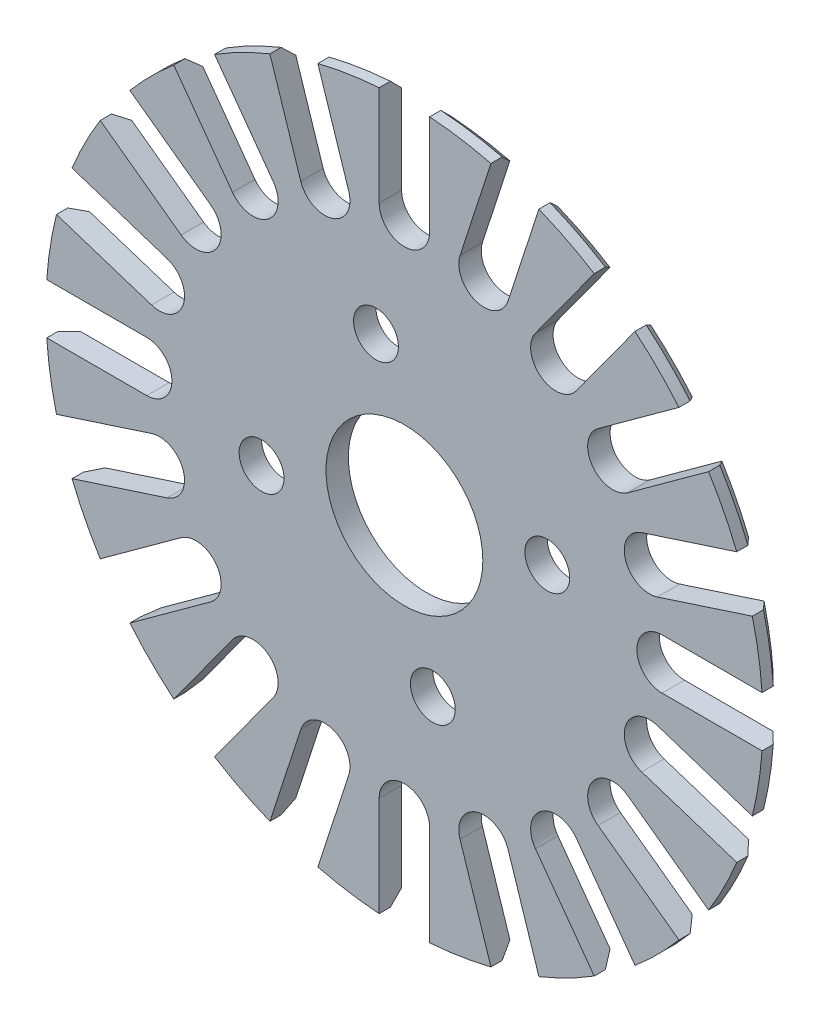
from build123d import *

# Parameters (mm, degrees)
SKETCH_1_R               = 32
EXTRUDE_1_DEPTH          = 2
SKETCH_2_R               = 7
CUT_EXTRUDE_2_DEPTH      = 3
SKETCH_3_R               = 2
CUT_EXTRUDE_3_DEPTH      = 3
PATTERN_CIRCULAR_1_COUNT = 4
CHAMFER_1_SIZE           = 1
CUT_EXTRUDE_START        = -3
CUT_EXTRUDE_4_DEPTH      = 3
PATTERN_CIRCULAR_3_COUNT = 20


with BuildPart() as part:
    # 草图1 → 拉伸1 (new body)
    with BuildSketch(Plane.XY):
        Circle(SKETCH_1_R)
    extrude(amount=EXTRUDE_1_DEPTH)

    # 草图2 → 拉伸2 (cut)
    with BuildSketch(Plane.XY.offset(2)):
        Circle(SKETCH_2_R)
    extrude(amount=-CUT_EXTRUDE_2_DEPTH, mode=Mode.SUBTRACT)

    # 草图3 → 拉伸3 (cut)
    with BuildSketch(Plane.XY.offset(2)):
        with Locations((-2.536174186, 12.750208645)):
            Circle(SKETCH_3_R)
    cut_extrude_3 = extrude(amount=-CUT_EXTRUDE_3_DEPTH, mode=Mode.SUBTRACT)

    # 阵列(圆周)1: 拉伸3 ×4 about axis
    pattern_circular_1_axis = Axis((0, 0, 0), (0, 0, 1))
    for i in range(1, PATTERN_CIRCULAR_1_COUNT):
        add(cut_extrude_3.rotate(pattern_circular_1_axis, i * 360 / PATTERN_CIRCULAR_1_COUNT), mode=Mode.SUBTRACT)

    # 倒角1
    chamfer_1_edges = [part.edges().sort_by_distance(p)[0] for p in [
        (-32, 0, 0),
    ]]
    chamfer(chamfer_1_edges, length=CHAMFER_1_SIZE)

    # 草图4 → 拉伸4 (cut)
    with BuildSketch(Plane.XY.offset(2).offset(CUT_EXTRUDE_START)):
        with BuildLine():
            Line((-23, 2.25), (-31.920800429, 2.25))
            ThreePointArc((-31.920800429, 2.25), (-32, 0), (-31.920800429, -2.25))
            Line((-31.920800429, -2.25), (-23, -2.25))
            ThreePointArc((-23, -2.25), (-20.75, 0), (-23, 2.25))
        make_face()
    cut_extrude_4 = extrude(amount=CUT_EXTRUDE_4_DEPTH, mode=Mode.SUBTRACT)

    # 阵列(圆周)3: 拉伸4 ×20 about axis
    pattern_circular_3_axis = Axis((0, 0, 0), (0, 0, 1))
    for i in range(1, PATTERN_CIRCULAR_3_COUNT):
        add(cut_extrude_4.rotate(pattern_circular_3_axis, i * 360 / PATTERN_CIRCULAR_3_COUNT), mode=Mode.SUBTRACT)


solid = part.part
